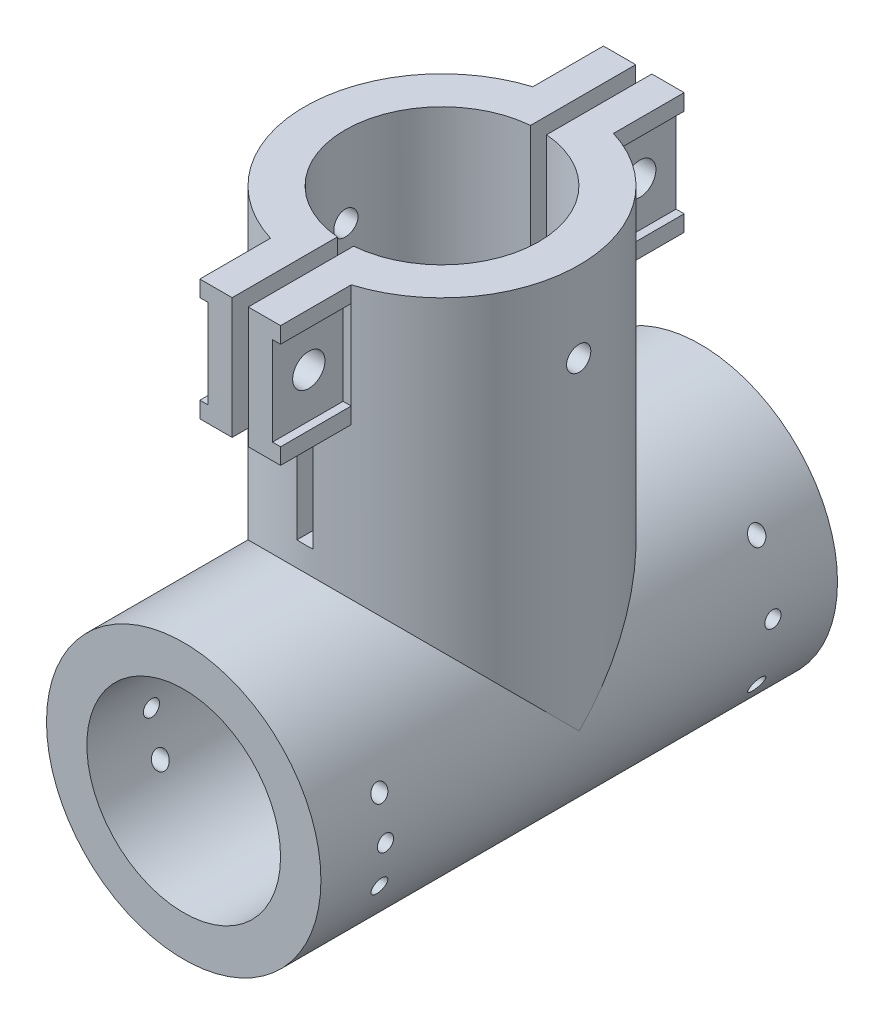
from build123d import *

# Parameters (mm, degrees)
IZIM1_R                     = 17
IZIM1_R_2                   = 12
Y_KSEKLIK_EKSTR_ZYON1_DEPTH = 64
IZIM2_R                     = 17
IZIM2_R_2                   = 12
Y_KSEKLIK_EKSTR_ZYON2_DEPTH = 50
IZIM3_R                     = 12
KES_EKSTR_ZYON2_DEPTH       = 98.406806537
IZIM6_W                     = 10
IZIM6_H                     = 15
Y_KSEKLIK_EKSTR_ZYON3_DEPTH = 25
IZIM7_W                     = 2
IZIM7_H                     = 30
KES_EKSTR_ZYON5_DEPTH       = 50
KES_EKSTR_ZYON6_START       = -50
IZIM4_R                     = 12
KES_EKSTR_ZYON6_DEPTH       = 50
IZIM8_W                     = 8.751923191
IZIM8_H                     = 11
KES_EKSTR_ZYON7_DEPTH       = 1
IZIM9_R                     = 2
KES_EKSTR_ZYON8_DEPTH       = 87.59610122
IZIM10_R                    = 1
IZIM10_R_2                  = 1.5
KES_EKSTR_ZYON9_DEPTH       = 91.630484642
KES_EKSTR_ZYON10_DEPTH      = 1


with BuildPart() as part:
    # Çizim1 → Yükseklik-Ekstrüzyon1 (new body)
    with BuildSketch(Plane.XY):
        with Locations((-32.297070802, 4.423200443)):
            Circle(IZIM1_R)
        with Locations((-32.297070802, 4.423200443)):
            Circle(IZIM1_R_2, mode=Mode.SUBTRACT)
    extrude(amount=Y_KSEKLIK_EKSTR_ZYON1_DEPTH)

    # Çizim2 → Yükseklik-Ekstrüzyon2 (add)
    with BuildSketch(Plane(origin=(0, 4.423200443, 0), x_dir=(1, 0, 0), z_dir=(0, 1, 0))):
        with Locations((-32.297070802, -32)):
            Circle(IZIM2_R)
        with Locations((-32.297070802, -32)):
            Circle(IZIM2_R_2, mode=Mode.SUBTRACT)
    extrude(amount=Y_KSEKLIK_EKSTR_ZYON2_DEPTH)

    # Çizim3 → Kes-Ekstrüzyon2 (cut, through all)
    with BuildSketch(Plane.XY.offset(64)):
        with Locations((-32.297070802, 4.423200443)):
            Circle(IZIM3_R)
    extrude(amount=-KES_EKSTR_ZYON2_DEPTH, mode=Mode.SUBTRACT)

    # Çizim6 → Yükseklik-Ekstrüzyon3 (add, symmetric)
    with BuildSketch(Plane(origin=(0, 0, 32), x_dir=(-1, 0, 0), z_dir=(0, 0, -1))):
        with Locations((32.297070802, 46.923200443)):
            Rectangle(IZIM6_W, IZIM6_H)
    extrude(amount=Y_KSEKLIK_EKSTR_ZYON3_DEPTH, both=True)

    # Çizim7 → Kes-Ekstrüzyon5 (cut)
    with BuildSketch(Plane.XY.offset(57)):
        with Locations((-32.297070802, 39.423200443)):
            Rectangle(IZIM7_W, IZIM7_H)
    extrude(amount=-KES_EKSTR_ZYON5_DEPTH, mode=Mode.SUBTRACT)

    # Çizim4 → Kes-Ekstrüzyon6 (cut)
    with BuildSketch(Plane(origin=(0, 54.423200443, 0), x_dir=(1, 0, 0), z_dir=(0, 1, 0)).offset(KES_EKSTR_ZYON6_START)):
        with Locations((-32.297070802, -32)):
            Circle(IZIM4_R)
    extrude(amount=KES_EKSTR_ZYON6_DEPTH, mode=Mode.SUBTRACT)

    # Çizim8 → Kes-Ekstrüzyon7 (cut)
    with BuildSketch(Plane(origin=(-27.297070802, 0, 0), x_dir=(0, 0, -1), z_dir=(1, 0, 0))):
        with Locations((-52.624038404, 46.923200443)):
            Rectangle(IZIM8_W, IZIM8_H)
        with Locations((-11.375961596, 46.923200443)):
            Rectangle(IZIM8_W, IZIM8_H)
    extrude(amount=-KES_EKSTR_ZYON7_DEPTH, mode=Mode.SUBTRACT)

    # Çizim9 → Kes-Ekstrüzyon8 (cut, through all)
    with BuildSketch(Plane(origin=(-28.297070802, 0, 0), x_dir=(0, 0, -1), z_dir=(1, 0, 0))):
        with Locations((-52.5, 46.923200443)):
            Circle(IZIM9_R)
        with Locations((-11.5, 46.923200443)):
            Circle(IZIM9_R)
    extrude(amount=-KES_EKSTR_ZYON8_DEPTH, mode=Mode.SUBTRACT)

    # Çizim10 → Kes-Ekstrüzyon9 (cut, through all)
    with BuildSketch(Plane(origin=(-15.297070802, 0, 0), x_dir=(0, 0, -1), z_dir=(1, 0, 0))):
        with Locations((-56, 4.423200443)):
            Circle(IZIM10_R)
        with Locations((-56, 9.423200443)):
            Circle(IZIM10_R)
        with Locations((-56, -0.576799557)):
            Circle(IZIM10_R)
        with Locations((-8, 4.423200443)):
            Circle(IZIM10_R)
        with Locations((-8, 12.423200443)):
            Circle(IZIM10_R)
        with Locations((-8, -3.576799557)):
            Circle(IZIM10_R)
        with Locations((-32, 44.423200443)):
            Circle(IZIM10_R_2)
    extrude(amount=-KES_EKSTR_ZYON9_DEPTH, mode=Mode.SUBTRACT)

    # Çizim11 → Kes-Ekstrüzyon10 (cut)
    with BuildSketch(Plane.ZY.offset(37.297070802)):
        Polygon((15.751923191, 51.423200443), (9.767949192, 51.423200443), (9.767949192, 49.923200443), (11.5, 50.923200443), (14.964101615, 48.923200443), (14.964101615, 44.923200443), (11.5, 42.923200443), (9.767949192, 43.923200443), (9.767949192, 42.423200443), (15.751923191, 42.423200443), (15.751923191, 41.423200443), (7, 41.423200443), (7, 42.423200443), (7, 51.423200443), (7, 52.423200443), (15.751923191, 52.423200443), align=None)
        Polygon((48.248076809, 42.423200443), (48.248076809, 41.423200443), (57, 41.423200443), (57, 42.423200443), (57, 51.423200443), (57, 52.423200443), (48.248076809, 52.423200443), (48.248076809, 51.423200443), (54.232050808, 51.423200443), (54.232050808, 49.923200443), (52.5, 50.923200443), (49.035898385, 48.923200443), (49.035898385, 44.923200443), (52.5, 42.923200443), (54.232050808, 43.923200443), (54.232050808, 42.423200443), align=None)
    extrude(amount=-KES_EKSTR_ZYON10_DEPTH, mode=Mode.SUBTRACT)


solid = part.part
